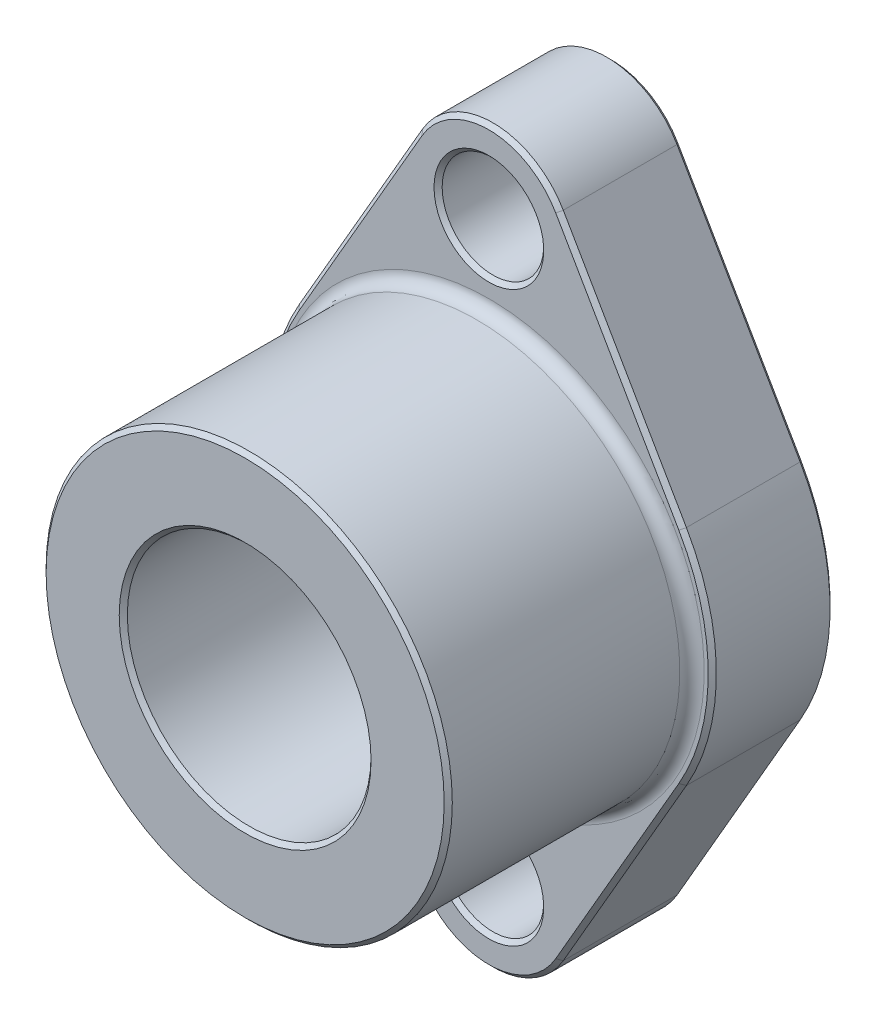
from build123d import *

# Parameters (mm, degrees)
SKETCH1_R           = 5
BOSS_EXTRUDE1_DEPTH = 6
BOSS_EXTRUDE2_DEPTH = 3
SKETCH3_R           = 3
SKETCH3_R_2         = 1.25
CUT_EXTRUDE1_DEPTH  = 14.865424624
FILLET1_R           = 0.3
CHAMFER1_SIZE       = 0.1


with BuildPart() as part:
    # Sketch1 → Boss-Extrude1 (new body)
    with BuildSketch(Plane.XY):
        Circle(SKETCH1_R)
    extrude(amount=BOSS_EXTRUDE1_DEPTH)

    # Sketch2 → Boss-Extrude2 (add)
    with BuildSketch(Plane(origin=(0, 0, 0), x_dir=(-1, 0, 0), z_dir=(0, 0, -1))):
        with BuildLine():
            Line((-4.763139721, 2.75), (-1.732050808, 8))
            ThreePointArc((-1.732050808, 8), (0, 9), (1.732050808, 8))
            Line((1.732050808, 8), (4.763139721, 2.75))
            ThreePointArc((4.763139721, 2.75), (5.5, 0), (4.763139721, -2.75))
            Line((4.763139721, -2.75), (1.732050808, -8))
            ThreePointArc((1.732050808, -8), (0, -9), (-1.732050808, -8))
            Line((-1.732050808, -8), (-4.763139721, -2.75))
            ThreePointArc((-4.763139721, -2.75), (-5.5, 0), (-4.763139721, 2.75))
        make_face()
    extrude(amount=BOSS_EXTRUDE2_DEPTH)

    # Sketch3 → Cut-Extrude1 (cut, through all)
    with BuildSketch(Plane(origin=(0, 0, -3), x_dir=(-1, 0, 0), z_dir=(0, 0, -1))):
        Circle(SKETCH3_R)
        with Locations((0, 7)):
            Circle(SKETCH3_R_2)
        with Locations((0, -7)):
            Circle(SKETCH3_R_2)
    extrude(amount=-CUT_EXTRUDE1_DEPTH, mode=Mode.SUBTRACT)

    # Fillet1
    fillet1_edges = [part.edges().sort_by_distance(p)[0] for p in [
        (-5, 0, 0),
    ]]
    fillet(fillet1_edges, radius=FILLET1_R)

    # Chamfer1
    chamfer1_edges = [part.edges().sort_by_distance(p)[0] for p in [
        (-3.247595264, -5.375, -3),
        (-5.5, 0, -3),
        (-3.247595264, 5.375, -3),
        (0, 9, -3),
        (3.247595264, 5.375, -3),
        (1.25, -7, 0),
        (1.25, -7, -3),
        (1.25, 7, 0),
        (1.25, 7, -3),
        (3, 0, 6),
        (3, 0, -3),
        (-5, 0, 6),
        (5.5, 0, 0),
        (3.247595264, -5.375, 0),
        (0, -9, 0),
        (-3.247595264, -5.375, 0),
        (-5.5, 0, 0),
        (-3.247595264, 5.375, 0),
        (0, 9, 0),
        (3.247595264, 5.375, 0),
        (5.5, 0, -3),
        (3.247595264, -5.375, -3),
        (0, -9, -3),
    ]]
    chamfer(chamfer1_edges, length=CHAMFER1_SIZE)


solid = part.part
